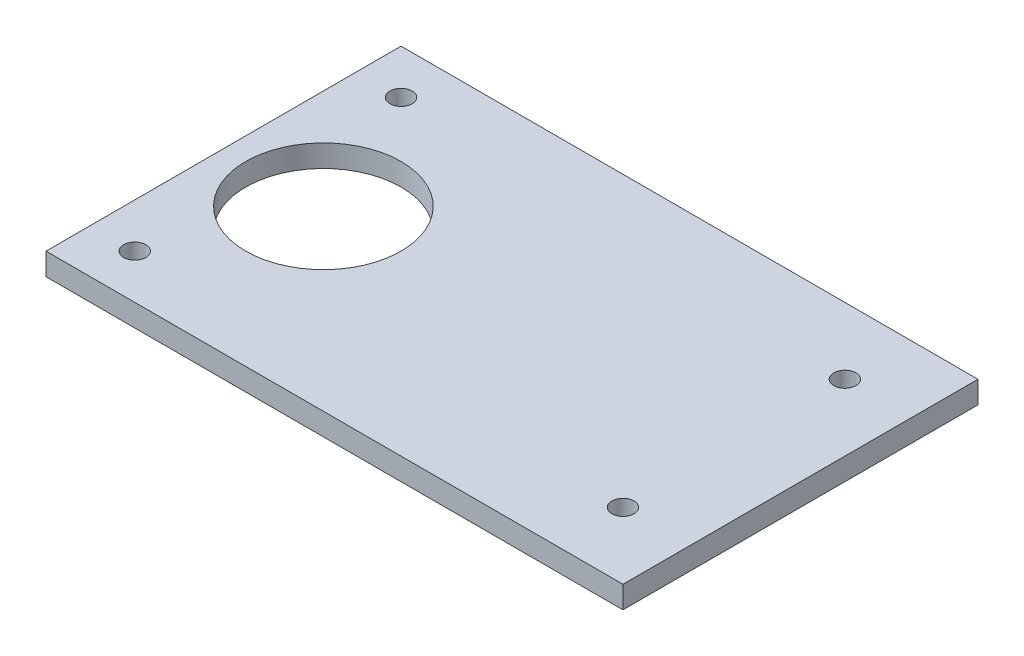
from build123d import *

# Parameters (mm, degrees)
SKETCH1_W           = 130
SKETCH1_H           = 80
SKETCH1_R           = 17.5
SKETCH1_R_2         = 2.5
BOSS_EXTRUDE1_DEPTH = 5


with BuildPart() as part:
    # Sketch1 → Boss-Extrude1 (new body)
    with BuildSketch(Plane(origin=(0, 0, 0), x_dir=(1, 0, 0), z_dir=(0, 1, 0))):
        with Locations((-4.718309859, -5.352112676)):
            Rectangle(SKETCH1_W, SKETCH1_H)
        with Locations(Location((-47.218309859, -5.352112676, 0), (0, 0, 270))):
            Circle(SKETCH1_R, mode=Mode.SUBTRACT)
        with Locations(Location((45.281690141, 19.647887324, 0), (0, 0, 270))):
            Circle(SKETCH1_R_2, mode=Mode.SUBTRACT)
        with Locations(Location((-59.718309859, 24.647887324, 0), (0, 0, 270))):
            Circle(SKETCH1_R_2, mode=Mode.SUBTRACT)
        with Locations(Location((45.281690141, -30.352112676, 0), (0, 0, 90))):
            Circle(SKETCH1_R_2, mode=Mode.SUBTRACT)
        with Locations(Location((-59.718309859, -35.352112676, 0), (0, 0, 90))):
            Circle(SKETCH1_R_2, mode=Mode.SUBTRACT)
    extrude(amount=BOSS_EXTRUDE1_DEPTH)


solid = part.part
